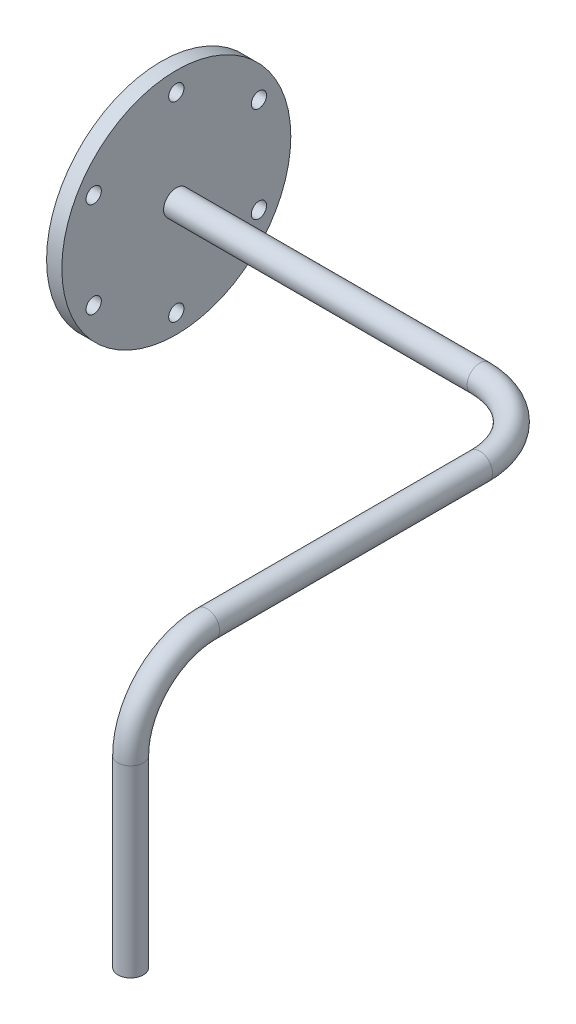
from build123d import *

# Parameters (mm, degrees)
SWEEP4_PROFILE_R    = 5
SWEEP6_PROFILE_R    = 5
SKETCH23_R          = 5
BOSS_EXTRUDE1_DEPTH = 119.29
SHELL1_T            = -2
CUT_EXTRUDE1_START  = -3.29
SKETCH25_R          = 3
CUT_EXTRUDE1_DEPTH  = 3.29
SKETCH26_R          = 45
BOSS_EXTRUDE2_DEPTH = 6
CUT_EXTRUDE2_START  = -8
SKETCH27_R          = 3
CUT_EXTRUDE2_DEPTH  = 8
CIRPATTERN1_COUNT   = 6


with BuildPart() as part:
    # Sweep4: sweep along a path in Sketch1
    with BuildLine(Plane(origin=(0, 0, 0), x_dir=(0, 0, -1), z_dir=(1, 0, 0))) as sweep4_path:
        Line((0, 0), (0, 72.19))
        ThreePointArc((0, 72.19), (8.786796564, 93.403203436), (30, 102.19))
        Line((30, 102.19), (137.24, 102.19))
    # Sweep4 profile (on start of the path) → Sweep4 (sweep)
    with BuildSketch(Plane.ZX):
        Circle(SWEEP4_PROFILE_R)
    sweep(path=sweep4_path.line)

    # Sweep6: sweep along a path in Sketch18
    with BuildLine(Plane(origin=(0, 102.19, 0), x_dir=(-1, 0, 0), z_dir=(0, -1, 0))) as sweep6_path:
        ThreePointArc((30, 167.24), (8.786796564, 158.453203436), (0, 137.24))
    # Sweep6 profile (on start of the path) → Sweep6 (sweep)
    with BuildSketch(Plane(origin=(-30, 102.19, -167.24), x_dir=(0, 0, 1), z_dir=(1, 0, 0))):
        Circle(SWEEP6_PROFILE_R)
    sweep(path=sweep6_path.line)

    # Sketch23 → Boss-Extrude1 (add)
    with BuildSketch(Plane.ZY.offset(30)):
        with Locations(Location((-167.24, 102.19, 0), (0, 0, 180))):
            Circle(SKETCH23_R)
    extrude(amount=BOSS_EXTRUDE1_DEPTH)

    # Shell1
    shell1_openings = [part.faces().sort_by_distance(p)[0] for p in [
        (-149.29, 102.19, -167.24),
    ]]
    offset(amount=SHELL1_T, openings=shell1_openings, kind=Kind.INTERSECTION)

    # Sketch25 → Cut-Extrude1 (cut)
    with BuildSketch(Plane.XZ.offset(CUT_EXTRUDE1_START)):
        with Locations(Location((0, 0, 0), (0, 0, 90))):
            Circle(SKETCH25_R)
    extrude(amount=CUT_EXTRUDE1_DEPTH, mode=Mode.SUBTRACT)


with BuildPart() as body_2:
    # Sketch26 → Boss-Extrude2 (new body)
    with BuildSketch(Plane.ZY.offset(149.29)):
        with Locations(Location((-167.24, 102.19, 0), (0, 0, 270))):
            Circle(SKETCH26_R)
    extrude(amount=BOSS_EXTRUDE2_DEPTH)

    # Sketch27 → Cut-Extrude2 (cut)
    with BuildSketch(Plane.ZY.offset(155.29).offset(CUT_EXTRUDE2_START)):
        with Locations(Location((-167.24, 102.19, 0), (0, 0, 270))):
            Circle(SKETCH27_R)
        with Locations(Location((-167.24, 139.69, 0), (0, 0, 270))):
            Circle(SKETCH27_R)
    cut_extrude2 = extrude(amount=CUT_EXTRUDE2_DEPTH, mode=Mode.SUBTRACT)

    # CirPattern1: Cut-Extrude2 ×6 about axis
    cirpattern1_axis = Axis((0, 102.19, -167.24), (1, 0, 0))
    for i in range(1, CIRPATTERN1_COUNT):
        add(cut_extrude2.rotate(cirpattern1_axis, i * 360 / CIRPATTERN1_COUNT), mode=Mode.SUBTRACT)


solid = Compound([part.part, body_2.part])
